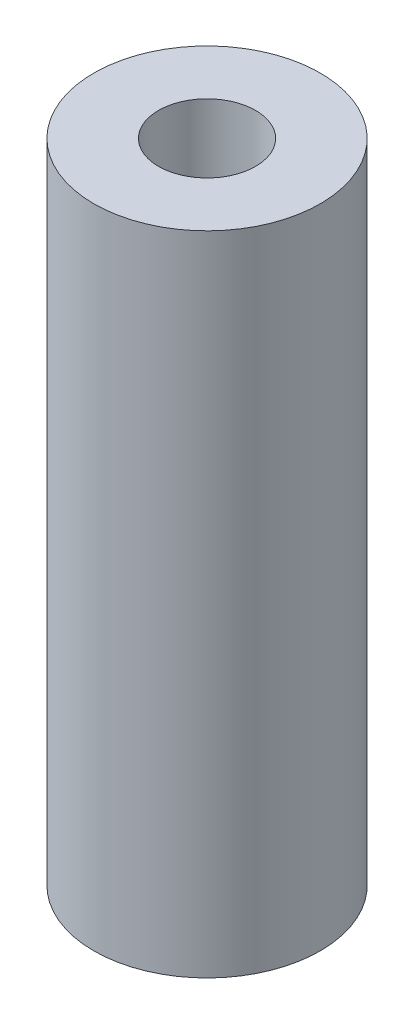
from build123d import *

# Parameters (mm, degrees)
SKETCH1_R           = 3.5
SKETCH1_R_2         = 1.5
BOSS_EXTRUDE1_DEPTH = 20


with BuildPart() as part:
    # Sketch1 → Boss-Extrude1 (new body)
    with BuildSketch(Plane(origin=(0, 0, 0), x_dir=(1, 0, 0), z_dir=(0, 1, 0))):
        with Locations(Location((0, 0, 0), (0, 0, 270))):
            Circle(SKETCH1_R)
        with Locations(Location((0, 0, 0), (0, 0, 270))):
            Circle(SKETCH1_R_2, mode=Mode.SUBTRACT)
    extrude(amount=BOSS_EXTRUDE1_DEPTH)


solid = part.part
